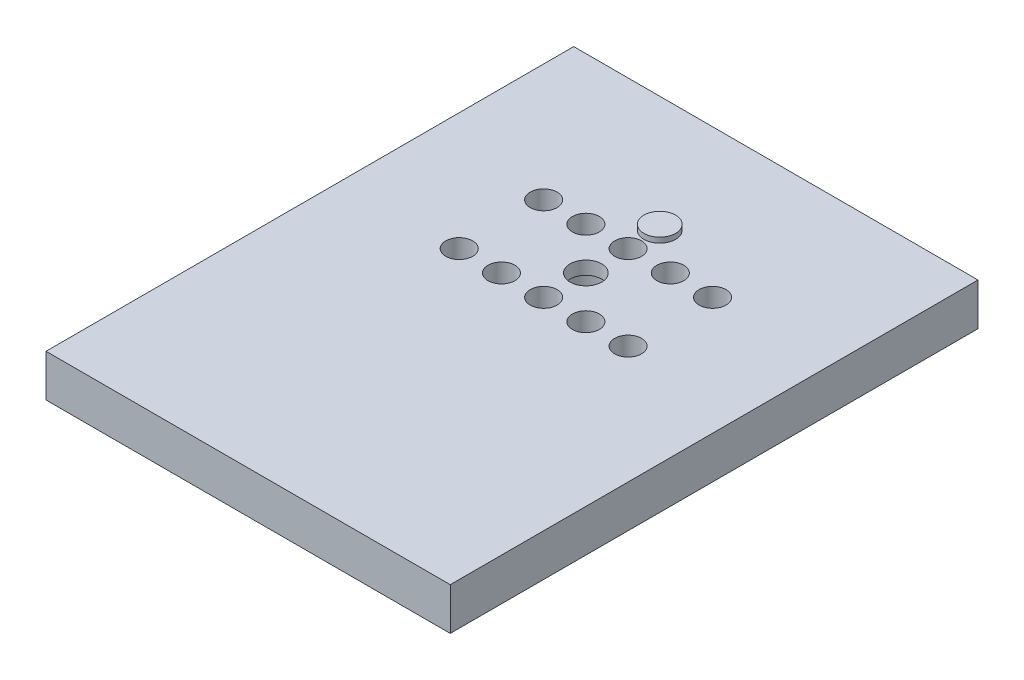
from build123d import *

# Parameters (mm, degrees)
SKETCH_1_W          = 76.6
SKETCH_1_H          = 100
SKETCH_1_R          = 3
EXTRUDE_1_DEPTH     = 8
SKETCH_2_R          = 4.5
CUT_EXTRUDE_1_DEPTH = 5.5
SKETCH_3_R          = 3
EXTRUDE_2_DEPTH     = 1
SKETCH_5_R          = 1.05
CUT_EXTRUDE_2_DEPTH = 64.489290435
SKETCH_6_R          = 2.55
CUT_EXTRUDE_3_DEPTH = 5


with BuildPart() as part:
    # ｽｹｯﾁ1 → ﾎﾞｽ - 押し出し1 (new body)
    with BuildSketch(Plane(origin=(0, 0, 0), x_dir=(1, 0, 0), z_dir=(0, 1, 0))):
        Rectangle(SKETCH_1_W, SKETCH_1_H)
        with Locations(Location((0, 14, 0), (0, 0, 270))):
            Circle(SKETCH_1_R, mode=Mode.SUBTRACT)
    extrude(amount=EXTRUDE_1_DEPTH)

    # ｽｹｯﾁ2 → ｶｯﾄ - 押し出し1 (cut)
    with BuildSketch(Plane.XZ):
        with Locations(Location((0, -14, 0), (0, 0, 270))):
            Circle(SKETCH_2_R)
    extrude(amount=-CUT_EXTRUDE_1_DEPTH, mode=Mode.SUBTRACT)

    # ｽｹｯﾁ3 → ﾎﾞｽ - 押し出し2 (add)
    with BuildSketch(Plane(origin=(0, 8, 0), x_dir=(1, 0, 0), z_dir=(0, 1, 0))):
        with Locations(Location((0, 28, 0), (0, 0, 270))):
            Circle(SKETCH_3_R)
    extrude(amount=EXTRUDE_2_DEPTH)

    # ｽｹｯﾁ5 → ｶｯﾄ - 押し出し2 (cut, through all)
    with BuildSketch(Plane(origin=(0, 8, 0), x_dir=(1, 0, 0), z_dir=(0, 1, 0))):
        with Locations(Location((0, 22, 0), (0, 0, 270))):
            Circle(SKETCH_5_R)
        with Locations(Location((8, 22, 0), (0, 0, 270))):
            Circle(SKETCH_5_R)
        with Locations(Location((16, 22, 0), (0, 0, 270))):
            Circle(SKETCH_5_R)
        with Locations(Location((-8, 22, 0), (0, 0, 270))):
            Circle(SKETCH_5_R)
        with Locations(Location((-16, 22, 0), (0, 0, 270))):
            Circle(SKETCH_5_R)
        with Locations(Location((-16, 6, 0), (0, 0, 90))):
            Circle(SKETCH_5_R)
        with Locations(Location((-8, 6, 0), (0, 0, 90))):
            Circle(SKETCH_5_R)
        with Locations(Location((16, 6, 0), (0, 0, 90))):
            Circle(SKETCH_5_R)
        with Locations(Location((8, 6, 0), (0, 0, 90))):
            Circle(SKETCH_5_R)
        with Locations(Location((0, 6, 0), (0, 0, 90))):
            Circle(SKETCH_5_R)
    extrude(amount=-CUT_EXTRUDE_2_DEPTH, mode=Mode.SUBTRACT)

    # ｽｹｯﾁ6 → ｶｯﾄ - 押し出し3 (cut)
    with BuildSketch(Plane(origin=(0, 8, 0), x_dir=(1, 0, 0), z_dir=(0, 1, 0))):
        with Locations(Location((-8, 22, 0), (0, 0, 270))):
            Circle(SKETCH_6_R)
        with Locations(Location((-16, 22, 0), (0, 0, 270))):
            Circle(SKETCH_6_R)
        with Locations(Location((0, 22, 0), (0, 0, 270))):
            Circle(SKETCH_6_R)
        with Locations(Location((8, 22, 0), (0, 0, 270))):
            Circle(SKETCH_6_R)
        with Locations(Location((16, 22, 0), (0, 0, 270))):
            Circle(SKETCH_6_R)
        with Locations(Location((-8, 6, 0), (0, 0, 270))):
            Circle(SKETCH_6_R)
        with Locations(Location((0, 6, 0), (0, 0, 270))):
            Circle(SKETCH_6_R)
        with Locations(Location((8, 6, 0), (0, 0, 270))):
            Circle(SKETCH_6_R)
        with Locations(Location((16, 6, 0), (0, 0, 270))):
            Circle(SKETCH_6_R)
        with Locations(Location((-16, 6, 0), (0, 0, 270))):
            Circle(SKETCH_6_R)
    extrude(amount=-CUT_EXTRUDE_3_DEPTH, mode=Mode.SUBTRACT)


solid = part.part
